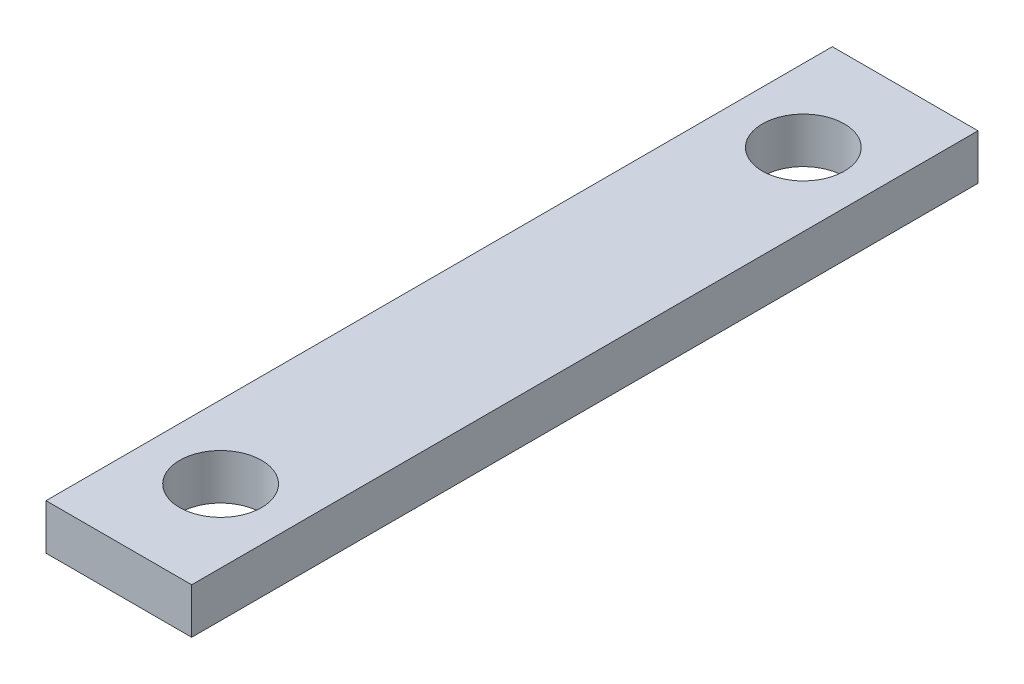
from build123d import *

# Parameters (mm, degrees)
SKETCH1_W           = 8
SKETCH1_H           = 43.18
SKETCH1_R           = 2.25
BOSS_EXTRUDE1_DEPTH = 2.5


with BuildPart() as part:
    # Sketch1 → Boss-Extrude1 (new body)
    with BuildSketch(Plane(origin=(0, -24, 0), x_dir=(-1, 0, 0), z_dir=(0, -1, 0))):
        with Locations((43.37, 0)):
            Rectangle(SKETCH1_W, SKETCH1_H)
        with Locations(Location((43.37, -16, 0), (0, 0, 90))):
            Circle(SKETCH1_R, mode=Mode.SUBTRACT)
        with Locations(Location((43.37, 16, 0), (0, 0, 90))):
            Circle(SKETCH1_R, mode=Mode.SUBTRACT)
    extrude(amount=BOSS_EXTRUDE1_DEPTH)


solid = part.part
